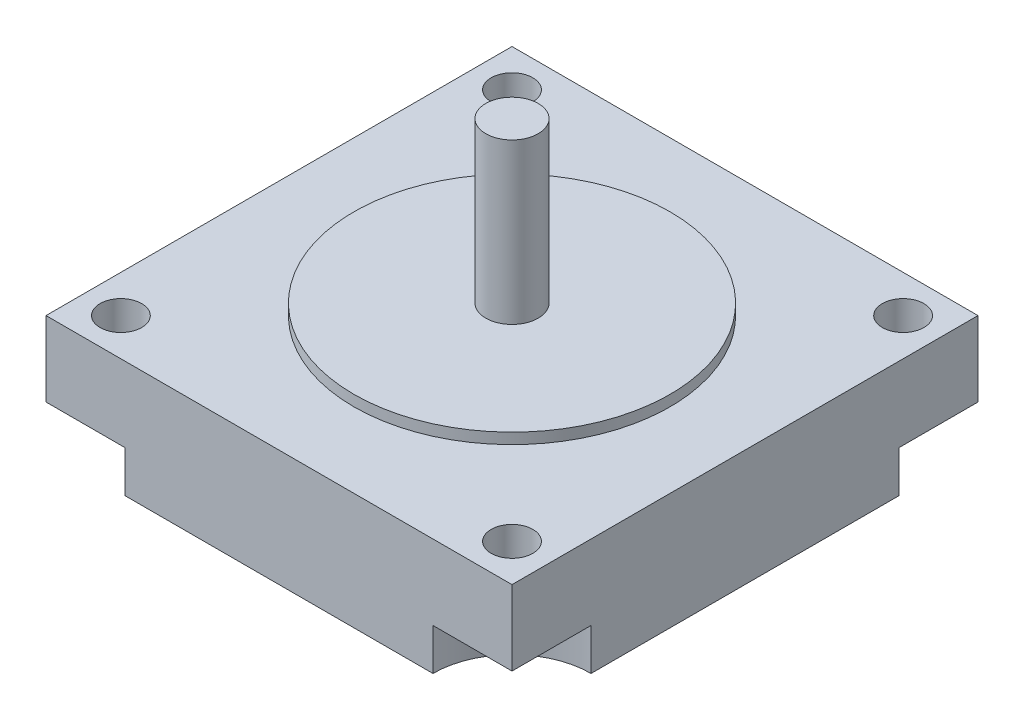
from build123d import *

# Parameters (mm, degrees)
BOSS_EXTRUDE5_DEPTH = 5
SKETCH6_W           = 56
SKETCH6_H           = 56
BOSS_EXTRUDE6_DEPTH = 9
SKETCH7_R           = 19
BOSS_EXTRUDE7_DEPTH = 1.3
SKETCH8_R           = 2.5
CUT_EXTRUDE1_DEPTH  = 43
SKETCH9_R           = 3.15
BOSS_EXTRUDE8_DEPTH = 19.2


with BuildPart() as part:
    # Sketch1 → Boss-Extrude5 (new body)
    with BuildSketch(Plane(origin=(0, 0, 0), x_dir=(1, 0, 0), z_dir=(0, 1, 0))):
        with BuildLine():
            Line((-18.5, 28), (18.5, 28))
            ThreePointArc((18.5, 28), (21.282485579, 21.282485579), (28, 18.5))
            Line((28, 18.5), (28, -18.5))
            ThreePointArc((28, -18.5), (21.282485579, -21.282485579), (18.5, -28))
            Line((18.5, -28), (-18.5, -28))
            ThreePointArc((-18.5, -28), (-21.282485579, -21.282485579), (-28, -18.5))
            Line((-28, -18.5), (-28, 18.5))
            ThreePointArc((-28, 18.5), (-21.282485579, 21.282485579), (-18.5, 28))
        make_face()
    extrude(amount=BOSS_EXTRUDE5_DEPTH)

    # Sketch6 → Boss-Extrude6 (add)
    with BuildSketch(Plane(origin=(0, 5, 0), x_dir=(1, 0, 0), z_dir=(0, 1, 0))):
        Rectangle(SKETCH6_W, SKETCH6_H)
    extrude(amount=BOSS_EXTRUDE6_DEPTH)

    # Sketch7 → Boss-Extrude7 (add)
    with BuildSketch(Plane(origin=(0, 14, 0), x_dir=(1, 0, 0), z_dir=(0, 1, 0))):
        with Locations(Location((0, 0, 0), (0, 0, 270))):
            Circle(SKETCH7_R)
    extrude(amount=BOSS_EXTRUDE7_DEPTH)

    # Sketch8 → Cut-Extrude1 (cut, through all)
    with BuildSketch(Plane(origin=(0, 14, 0), x_dir=(1, 0, 0), z_dir=(0, 1, 0))):
        with Locations(Location((-23.5, 23.5, 0), (0, 0, 270))):
            Circle(SKETCH8_R)
        with Locations(Location((23.5, 23.5, 0), (0, 0, 270))):
            Circle(SKETCH8_R)
        with Locations(Location((23.5, -23.5, 0), (0, 0, 270))):
            Circle(SKETCH8_R)
        with Locations(Location((-23.5, -23.5, 0), (0, 0, 270))):
            Circle(SKETCH8_R)
    extrude(amount=-CUT_EXTRUDE1_DEPTH, mode=Mode.SUBTRACT)

    # Sketch9 → Boss-Extrude8 (add)
    with BuildSketch(Plane(origin=(0, 15.3, 0), x_dir=(1, 0, 0), z_dir=(0, 1, 0))):
        with Locations(Location((0, 0, 0), (0, 0, 270))):
            Circle(SKETCH9_R)
    extrude(amount=BOSS_EXTRUDE8_DEPTH)


solid = part.part
